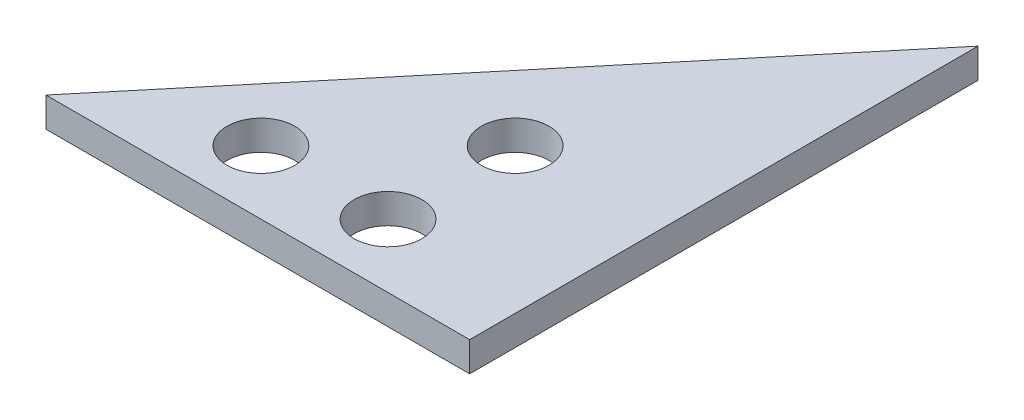
from build123d import *

# Parameters (mm, degrees)
BOSS_EXTRUDE1_DEPTH = 3.5
SKETCH2_R           = 4
CUT_EXTRUDE1_DEPTH  = 3.5


with BuildPart() as part:
    # Sketch1 → Boss-Extrude1 (new body)
    with BuildSketch(Plane(origin=(0, 0, 0), x_dir=(1, 0, 0), z_dir=(0, 1, 0))):
        Polygon((-2.765266864, -5.675626657), (47.234733136, -5.675626657), (47.234733136, 54.324373343), align=None)
    extrude(amount=BOSS_EXTRUDE1_DEPTH)

    # Sketch2 → Cut-Extrude1 (cut)
    with BuildSketch(Plane(origin=(0, 3.5, 0), x_dir=(1, 0, 0), z_dir=(0, 1, 0))):
        with Locations(Location((30.101973136, 1.824373343, 0), (0, 0, 270))):
            Circle(SKETCH2_R)
        with Locations(Location((15.101973136, 1.824373343, 0), (0, 0, 270))):
            Circle(SKETCH2_R)
        with Locations(Location((30.101973136, 16.824373343, 0), (0, 0, 270))):
            Circle(SKETCH2_R)
    extrude(amount=-CUT_EXTRUDE1_DEPTH, mode=Mode.SUBTRACT)


solid = part.part
